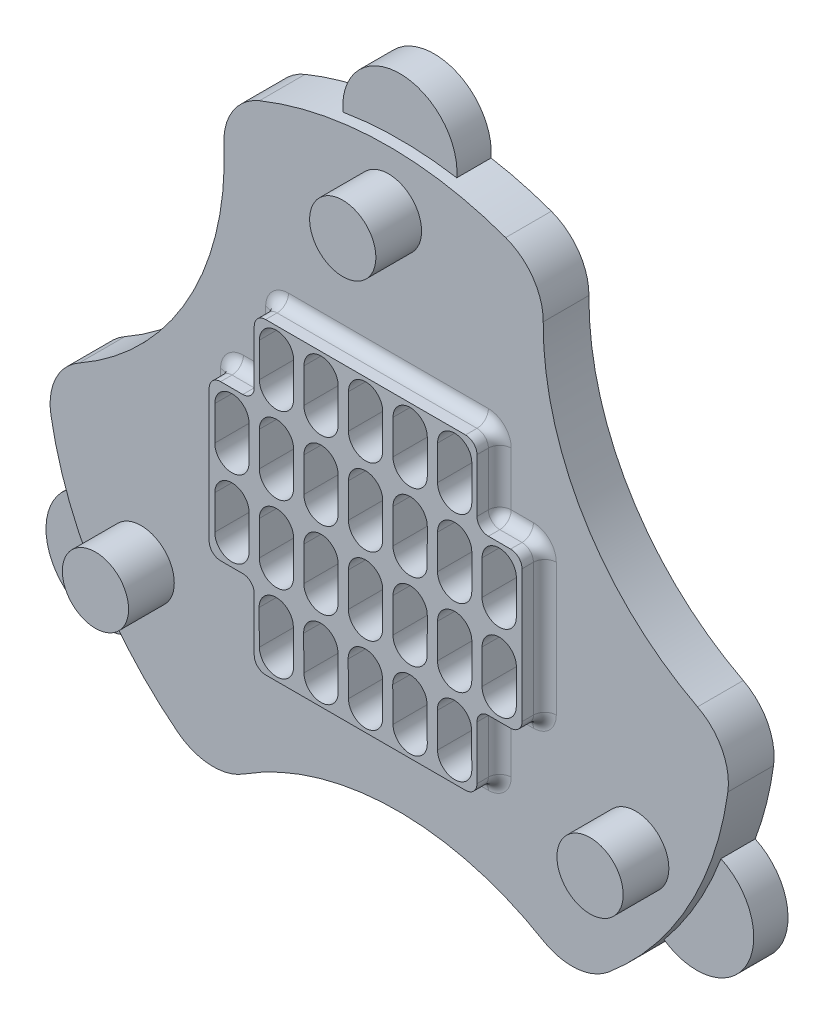
from build123d import *

# Parameters (mm, degrees)
SKETCH2_R                = 18.85
BOSS_EXTRUDE1_DEPTH      = 4
SKETCH3_R                = 30
SKETCH3_R_2              = 17.600030795
BOSS_EXTRUDE2_DEPTH      = 4
BOSS_EXTRUDE3_DEPTH      = 4
BOSS_EXTRUDE3_DEPTH_BACK = 4
SKETCH4_R                = 2.9
SKETCH6_R                = 5
BOSS_EXTRUDE4_DEPTH      = 3
SKETCH7_R                = 25
CUT_EXTRUDE2_DEPTH       = 4
FILLET1_R                = 5
SKETCH2_2_R              = 18.85
BOSS_EXTRUDE5_DEPTH      = 6
SKETCH8_R                = 20.511068925
CUT_EXTRUDE3_DEPTH       = 2
FILLET2_R                = 1
FILLET3_R                = 1


with BuildPart() as part:
    # Sketch2 → Boss-Extrude1 (new body)
    with BuildSketch(Plane.XY.offset(10)):
        Circle(SKETCH2_R)
        with BuildLine():
            Line((-6.300750604, 11.631897337), (-6.301949779, 8.631897576))
            ThreePointArc((-6.301949779, 8.631897576), (-7.802549247, 7.132497284), (-9.30194954, 8.633096752))
            Line((-9.30194954, 8.633096752), (-9.300750364, 11.633096512))
            ThreePointArc((-9.300750364, 11.633096512), (-7.800150896, 13.132496805), (-6.300750604, 11.631897337))
        make_face(mode=Mode.SUBTRACT)
        with BuildLine():
            Line((-5.400750364, 11.633096512), (-5.40194954, 8.633096752))
            ThreePointArc((-5.40194954, 8.633096752), (-3.902549247, 7.132497284), (-2.401949779, 8.631897576))
            Line((-2.401949779, 8.631897576), (-2.400750604, 11.631897337))
            ThreePointArc((-2.400750604, 11.631897337), (-3.900150896, 13.132496805), (-5.400750364, 11.633096512))
        make_face(mode=Mode.SUBTRACT)
        with BuildLine():
            Line((-1.500750364, 11.633096512), (-1.50194954, 8.633096752))
            ThreePointArc((-1.50194954, 8.633096752), (-0.002549247, 7.132497284), (1.498050221, 8.631897576))
            Line((1.498050221, 8.631897576), (1.499249396, 11.631897337))
            ThreePointArc((1.499249396, 11.631897337), (-0.000150896, 13.132496805), (-1.500750364, 11.633096512))
        make_face(mode=Mode.SUBTRACT)
        with BuildLine():
            Line((2.399249636, 11.633096512), (2.39805046, 8.633096752))
            ThreePointArc((2.39805046, 8.633096752), (3.897450753, 7.132497284), (5.398050221, 8.631897576))
            Line((5.398050221, 8.631897576), (5.399249396, 11.631897337))
            ThreePointArc((5.399249396, 11.631897337), (3.899849104, 13.132496805), (2.399249636, 11.633096512))
        make_face(mode=Mode.SUBTRACT)
        with BuildLine():
            Line((6.299249636, 11.633096512), (6.29805046, 8.633096752))
            ThreePointArc((6.29805046, 8.633096752), (7.797450753, 7.132497284), (9.298050221, 8.631897576))
            Line((9.298050221, 8.631897576), (9.299249396, 11.631897337))
            ThreePointArc((9.299249396, 11.631897337), (7.799849104, 13.132496805), (6.299249636, 11.633096512))
        make_face(mode=Mode.SUBTRACT)
        with BuildLine():
            Line((-10.203450815, 1.876748439), (-10.201950263, 4.876748439))
            ThreePointArc((-10.201950263, 4.876748439), (-11.701199799, 6.377498527), (-13.201949888, 4.878248991))
            Line((-13.201949888, 4.878248991), (-13.20345044, 1.878248991))
            ThreePointArc((-13.20345044, 1.878248991), (-11.704200903, 0.377498902), (-10.203450815, 1.876748439))
        make_face(mode=Mode.SUBTRACT)
        with BuildLine():
            Line((-9.303450024, 1.878248991), (-9.301949472, 4.878248991))
            ThreePointArc((-9.301949472, 4.878248991), (-7.801199384, 6.377498527), (-6.301949847, 4.876748439))
            Line((-6.301949847, 4.876748439), (-6.3034504, 1.876748439))
            ThreePointArc((-6.3034504, 1.876748439), (-7.804200488, 0.377498902), (-9.303450024, 1.878248991))
        make_face(mode=Mode.SUBTRACT)
        with BuildLine():
            Line((-2.4034504, 1.876748439), (-2.401949847, 4.876748439))
            ThreePointArc((-2.401949847, 4.876748439), (-3.901199384, 6.377498527), (-5.401949472, 4.878248991))
            Line((-5.401949472, 4.878248991), (-5.403450024, 1.878248991))
            ThreePointArc((-5.403450024, 1.878248991), (-3.904200488, 0.377498902), (-2.4034504, 1.876748439))
        make_face(mode=Mode.SUBTRACT)
        with BuildLine():
            Line((1.4965496, 1.876748439), (1.498050153, 4.876748439))
            ThreePointArc((1.498050153, 4.876748439), (-0.001199384, 6.377498527), (-1.501949472, 4.878248991))
            Line((-1.501949472, 4.878248991), (-1.503450024, 1.878248991))
            ThreePointArc((-1.503450024, 1.878248991), (-0.004200488, 0.377498902), (1.4965496, 1.876748439))
        make_face(mode=Mode.SUBTRACT)
        with BuildLine():
            Line((5.3965496, 1.876748439), (5.398050153, 4.876748439))
            ThreePointArc((5.398050153, 4.876748439), (3.898800616, 6.377498527), (2.398050528, 4.878248991))
            Line((2.398050528, 4.878248991), (2.396549976, 1.878248991))
            ThreePointArc((2.396549976, 1.878248991), (3.895799512, 0.377498902), (5.3965496, 1.876748439))
        make_face(mode=Mode.SUBTRACT)
        with BuildLine():
            Line((9.2965496, 1.876748439), (9.298050153, 4.876748439))
            ThreePointArc((9.298050153, 4.876748439), (7.798800616, 6.377498527), (6.298050528, 4.878248991))
            Line((6.298050528, 4.878248991), (6.296549976, 1.878248991))
            ThreePointArc((6.296549976, 1.878248991), (7.795799512, 0.377498902), (9.2965496, 1.876748439))
        make_face(mode=Mode.SUBTRACT)
        with BuildLine():
            Line((13.1965496, 1.876748439), (13.198050153, 4.876748439))
            ThreePointArc((13.198050153, 4.876748439), (11.698800616, 6.377498527), (10.198050528, 4.878248991))
            Line((10.198050528, 4.878248991), (10.196549976, 1.878248991))
            ThreePointArc((10.196549976, 1.878248991), (11.695799512, 0.377498902), (13.1965496, 1.876748439))
        make_face(mode=Mode.SUBTRACT)
        with BuildLine():
            Line((-9.304647729, -4.877109305), (-9.30074961, -1.877109305))
            ThreePointArc((-9.30074961, -1.877109305), (-7.798801818, -0.37905963), (-6.300752142, -1.881007421))
            Line((-6.300752142, -1.881007421), (-6.304650262, -4.881007421))
            ThreePointArc((-6.304650262, -4.881007421), (-7.806598054, -6.379057097), (-9.304647729, -4.877109305))
        make_face(mode=Mode.SUBTRACT)
        with BuildLine():
            Line((-2.404650262, -4.881007421), (-2.400752142, -1.881007421))
            ThreePointArc((-2.400752142, -1.881007421), (-3.898801818, -0.37905963), (-5.40074961, -1.877109305))
            Line((-5.40074961, -1.877109305), (-5.404647729, -4.877109305))
            ThreePointArc((-5.404647729, -4.877109305), (-3.906598054, -6.379057097), (-2.404650262, -4.881007421))
        make_face(mode=Mode.SUBTRACT)
        with BuildLine():
            Line((1.495349738, -4.881007421), (1.499247858, -1.881007421))
            ThreePointArc((1.499247858, -1.881007421), (0.001198182, -0.37905963), (-1.50074961, -1.877109305))
            Line((-1.50074961, -1.877109305), (-1.504647729, -4.877109305))
            ThreePointArc((-1.504647729, -4.877109305), (-0.006598054, -6.379057097), (1.495349738, -4.881007421))
        make_face(mode=Mode.SUBTRACT)
        with BuildLine():
            Line((5.395349738, -4.881007421), (5.399247858, -1.881007421))
            ThreePointArc((5.399247858, -1.881007421), (3.901198182, -0.37905963), (2.39925039, -1.877109305))
            Line((2.39925039, -1.877109305), (2.395352271, -4.877109305))
            ThreePointArc((2.395352271, -4.877109305), (3.893401946, -6.379057097), (5.395349738, -4.881007421))
        make_face(mode=Mode.SUBTRACT)
        with BuildLine():
            Line((9.295349738, -4.881007421), (9.299247858, -1.881007421))
            ThreePointArc((9.299247858, -1.881007421), (7.801198182, -0.37905963), (6.29925039, -1.877109305))
            Line((6.29925039, -1.877109305), (6.295352271, -4.877109305))
            ThreePointArc((6.295352271, -4.877109305), (7.793401946, -6.379057097), (9.295349738, -4.881007421))
        make_face(mode=Mode.SUBTRACT)
        with BuildLine():
            Line((13.195349738, -4.881007421), (13.199247858, -1.881007421))
            ThreePointArc((13.199247858, -1.881007421), (11.701198182, -0.37905963), (10.19925039, -1.877109305))
            Line((10.19925039, -1.877109305), (10.195352271, -4.877109305))
            ThreePointArc((10.195352271, -4.877109305), (11.693401946, -6.379057097), (13.195349738, -4.881007421))
        make_face(mode=Mode.SUBTRACT)
        with BuildLine():
            Line((-10.204650262, -4.881007421), (-10.200752142, -1.881007421))
            ThreePointArc((-10.200752142, -1.881007421), (-11.698801818, -0.37905963), (-13.20074961, -1.877109305))
            Line((-13.20074961, -1.877109305), (-13.204647729, -4.877109305))
            ThreePointArc((-13.204647729, -4.877109305), (-11.706598054, -6.379057097), (-10.204650262, -4.881007421))
        make_face(mode=Mode.SUBTRACT)
        with BuildLine():
            Line((-6.325942117, -8.623046013), (-6.300802019, -11.623046013))
            ThreePointArc((-6.300802019, -11.623046013), (-7.788179745, -13.135562955), (-9.300696687, -11.648185229))
            Line((-9.300696687, -11.648185229), (-9.325836785, -8.648185229))
            ThreePointArc((-9.325836785, -8.648185229), (-7.838459059, -7.135668287), (-6.325942117, -8.623046013))
        make_face(mode=Mode.SUBTRACT)
        with BuildLine():
            Line((-5.425836785, -8.648185229), (-5.400696687, -11.648185229))
            ThreePointArc((-5.400696687, -11.648185229), (-3.888179745, -13.135562955), (-2.400802019, -11.623046013))
            Line((-2.400802019, -11.623046013), (-2.425942117, -8.623046013))
            ThreePointArc((-2.425942117, -8.623046013), (-3.938459059, -7.135668287), (-5.425836785, -8.648185229))
        make_face(mode=Mode.SUBTRACT)
        with BuildLine():
            Line((-1.525836785, -8.648185229), (-1.500696687, -11.648185229))
            ThreePointArc((-1.500696687, -11.648185229), (0.011820255, -13.135562955), (1.499197981, -11.623046013))
            Line((1.499197981, -11.623046013), (1.474057883, -8.623046013))
            ThreePointArc((1.474057883, -8.623046013), (-0.038459059, -7.135668287), (-1.525836785, -8.648185229))
        make_face(mode=Mode.SUBTRACT)
        with BuildLine():
            Line((2.374163215, -8.648185229), (2.399303313, -11.648185229))
            ThreePointArc((2.399303313, -11.648185229), (3.911820255, -13.135562955), (5.399197981, -11.623046013))
            Line((5.399197981, -11.623046013), (5.374057883, -8.623046013))
            ThreePointArc((5.374057883, -8.623046013), (3.861540941, -7.135668287), (2.374163215, -8.648185229))
        make_face(mode=Mode.SUBTRACT)
        with BuildLine():
            Line((6.274163215, -8.648185229), (6.299303313, -11.648185229))
            ThreePointArc((6.299303313, -11.648185229), (7.811820255, -13.135562955), (9.299197981, -11.623046013))
            Line((9.299197981, -11.623046013), (9.274057883, -8.623046013))
            ThreePointArc((9.274057883, -8.623046013), (7.761540941, -7.135668287), (6.274163215, -8.648185229))
        make_face(mode=Mode.SUBTRACT)
    extrude(amount=BOSS_EXTRUDE1_DEPTH)

    # Sketch3 → Boss-Extrude2 (add)
    with BuildSketch(Plane.XY.offset(14)):
        Circle(SKETCH3_R)
        Circle(SKETCH3_R_2, mode=Mode.SUBTRACT)
    extrude(amount=-BOSS_EXTRUDE2_DEPTH)

    # Sketch4 → Boss-Extrude3 (add, two sides: drawn at the far end of the back side and taken through both)
    with BuildSketch(Plane.XY.offset(14).offset(-BOSS_EXTRUDE3_DEPTH_BACK)):
        with Locations((0, 25)):
            Circle(SKETCH4_R)
        with Locations((21.650635095, -12.5)):
            Circle(SKETCH4_R)
        with Locations((-21.650635095, -12.5)):
            Circle(SKETCH4_R)
    extrude(amount=BOSS_EXTRUDE3_DEPTH + BOSS_EXTRUDE3_DEPTH_BACK)

    # Sketch6 → Boss-Extrude4 (add)
    with BuildSketch(Plane(origin=(0, 0, 10), x_dir=(-1, 0, 0), z_dir=(0, 0, -1))):
        with Locations((0, 30)):
            Circle(SKETCH6_R)
        with Locations((25.980762114, -15)):
            Circle(SKETCH6_R)
        with Locations((-25.980762114, -15)):
            Circle(SKETCH6_R)
    extrude(amount=-BOSS_EXTRUDE4_DEPTH)

    # Sketch7 → Cut-Extrude2 (cut)
    with BuildSketch(Plane(origin=(0, 0, 10), x_dir=(-1, 0, 0), z_dir=(0, 0, -1))):
        with Locations((-38.550089681, 23.214017006)):
            Circle(SKETCH7_R)
        with Locations((39.378973292, 21.778348479)):
            Circle(SKETCH7_R)
        with Locations((-0.828883611, -44.992365485)):
            Circle(SKETCH7_R)
    extrude(amount=-CUT_EXTRUDE2_DEPTH, mode=Mode.SUBTRACT)

    # Fillet1
    fillet1_edges = [part.edges().sort_by_distance(p)[0] for p in [
        (-14.758617972, 26.118636939, 12),
        (-29.968117125, -1.382734963, 12),
        (-15.240094116, -25.840656558, 12),
        (16.181542167, -25.261783252, 12),
        (29.998712087, -0.277980381, 12),
        (13.786574958, 26.644518215, 12),
    ]]
    fillet(fillet1_edges, radius=FILLET1_R)

    # Sketch2<2> → Boss-Extrude5 (add)
    with BuildSketch(Plane.XY.offset(10)):
        Circle(SKETCH2_2_R)
        with BuildLine():
            Line((-6.300750604, 11.631897337), (-6.301949779, 8.631897576))
            ThreePointArc((-6.301949779, 8.631897576), (-7.802549247, 7.132497284), (-9.30194954, 8.633096752))
            Line((-9.30194954, 8.633096752), (-9.300750364, 11.633096512))
            ThreePointArc((-9.300750364, 11.633096512), (-7.800150896, 13.132496805), (-6.300750604, 11.631897337))
        make_face(mode=Mode.SUBTRACT)
        with BuildLine():
            Line((-5.400750364, 11.633096512), (-5.40194954, 8.633096752))
            ThreePointArc((-5.40194954, 8.633096752), (-3.902549247, 7.132497284), (-2.401949779, 8.631897576))
            Line((-2.401949779, 8.631897576), (-2.400750604, 11.631897337))
            ThreePointArc((-2.400750604, 11.631897337), (-3.900150896, 13.132496805), (-5.400750364, 11.633096512))
        make_face(mode=Mode.SUBTRACT)
        with BuildLine():
            Line((-1.500750364, 11.633096512), (-1.50194954, 8.633096752))
            ThreePointArc((-1.50194954, 8.633096752), (-0.002549247, 7.132497284), (1.498050221, 8.631897576))
            Line((1.498050221, 8.631897576), (1.499249396, 11.631897337))
            ThreePointArc((1.499249396, 11.631897337), (-0.000150896, 13.132496805), (-1.500750364, 11.633096512))
        make_face(mode=Mode.SUBTRACT)
        with BuildLine():
            Line((2.399249636, 11.633096512), (2.39805046, 8.633096752))
            ThreePointArc((2.39805046, 8.633096752), (3.897450753, 7.132497284), (5.398050221, 8.631897576))
            Line((5.398050221, 8.631897576), (5.399249396, 11.631897337))
            ThreePointArc((5.399249396, 11.631897337), (3.899849104, 13.132496805), (2.399249636, 11.633096512))
        make_face(mode=Mode.SUBTRACT)
        with BuildLine():
            Line((6.299249636, 11.633096512), (6.29805046, 8.633096752))
            ThreePointArc((6.29805046, 8.633096752), (7.797450753, 7.132497284), (9.298050221, 8.631897576))
            Line((9.298050221, 8.631897576), (9.299249396, 11.631897337))
            ThreePointArc((9.299249396, 11.631897337), (7.799849104, 13.132496805), (6.299249636, 11.633096512))
        make_face(mode=Mode.SUBTRACT)
        with BuildLine():
            Line((-10.203450815, 1.876748439), (-10.201950263, 4.876748439))
            ThreePointArc((-10.201950263, 4.876748439), (-11.701199799, 6.377498527), (-13.201949888, 4.878248991))
            Line((-13.201949888, 4.878248991), (-13.20345044, 1.878248991))
            ThreePointArc((-13.20345044, 1.878248991), (-11.704200903, 0.377498902), (-10.203450815, 1.876748439))
        make_face(mode=Mode.SUBTRACT)
        with BuildLine():
            Line((-9.303450024, 1.878248991), (-9.301949472, 4.878248991))
            ThreePointArc((-9.301949472, 4.878248991), (-7.801199384, 6.377498527), (-6.301949847, 4.876748439))
            Line((-6.301949847, 4.876748439), (-6.3034504, 1.876748439))
            ThreePointArc((-6.3034504, 1.876748439), (-7.804200488, 0.377498902), (-9.303450024, 1.878248991))
        make_face(mode=Mode.SUBTRACT)
        with BuildLine():
            Line((-2.4034504, 1.876748439), (-2.401949847, 4.876748439))
            ThreePointArc((-2.401949847, 4.876748439), (-3.901199384, 6.377498527), (-5.401949472, 4.878248991))
            Line((-5.401949472, 4.878248991), (-5.403450024, 1.878248991))
            ThreePointArc((-5.403450024, 1.878248991), (-3.904200488, 0.377498902), (-2.4034504, 1.876748439))
        make_face(mode=Mode.SUBTRACT)
        with BuildLine():
            Line((1.4965496, 1.876748439), (1.498050153, 4.876748439))
            ThreePointArc((1.498050153, 4.876748439), (-0.001199384, 6.377498527), (-1.501949472, 4.878248991))
            Line((-1.501949472, 4.878248991), (-1.503450024, 1.878248991))
            ThreePointArc((-1.503450024, 1.878248991), (-0.004200488, 0.377498902), (1.4965496, 1.876748439))
        make_face(mode=Mode.SUBTRACT)
        with BuildLine():
            Line((5.3965496, 1.876748439), (5.398050153, 4.876748439))
            ThreePointArc((5.398050153, 4.876748439), (3.898800616, 6.377498527), (2.398050528, 4.878248991))
            Line((2.398050528, 4.878248991), (2.396549976, 1.878248991))
            ThreePointArc((2.396549976, 1.878248991), (3.895799512, 0.377498902), (5.3965496, 1.876748439))
        make_face(mode=Mode.SUBTRACT)
        with BuildLine():
            Line((9.2965496, 1.876748439), (9.298050153, 4.876748439))
            ThreePointArc((9.298050153, 4.876748439), (7.798800616, 6.377498527), (6.298050528, 4.878248991))
            Line((6.298050528, 4.878248991), (6.296549976, 1.878248991))
            ThreePointArc((6.296549976, 1.878248991), (7.795799512, 0.377498902), (9.2965496, 1.876748439))
        make_face(mode=Mode.SUBTRACT)
        with BuildLine():
            Line((13.1965496, 1.876748439), (13.198050153, 4.876748439))
            ThreePointArc((13.198050153, 4.876748439), (11.698800616, 6.377498527), (10.198050528, 4.878248991))
            Line((10.198050528, 4.878248991), (10.196549976, 1.878248991))
            ThreePointArc((10.196549976, 1.878248991), (11.695799512, 0.377498902), (13.1965496, 1.876748439))
        make_face(mode=Mode.SUBTRACT)
        with BuildLine():
            Line((-9.304647729, -4.877109305), (-9.30074961, -1.877109305))
            ThreePointArc((-9.30074961, -1.877109305), (-7.798801818, -0.37905963), (-6.300752142, -1.881007421))
            Line((-6.300752142, -1.881007421), (-6.304650262, -4.881007421))
            ThreePointArc((-6.304650262, -4.881007421), (-7.806598054, -6.379057097), (-9.304647729, -4.877109305))
        make_face(mode=Mode.SUBTRACT)
        with BuildLine():
            Line((-2.404650262, -4.881007421), (-2.400752142, -1.881007421))
            ThreePointArc((-2.400752142, -1.881007421), (-3.898801818, -0.37905963), (-5.40074961, -1.877109305))
            Line((-5.40074961, -1.877109305), (-5.404647729, -4.877109305))
            ThreePointArc((-5.404647729, -4.877109305), (-3.906598054, -6.379057097), (-2.404650262, -4.881007421))
        make_face(mode=Mode.SUBTRACT)
        with BuildLine():
            Line((1.495349738, -4.881007421), (1.499247858, -1.881007421))
            ThreePointArc((1.499247858, -1.881007421), (0.001198182, -0.37905963), (-1.50074961, -1.877109305))
            Line((-1.50074961, -1.877109305), (-1.504647729, -4.877109305))
            ThreePointArc((-1.504647729, -4.877109305), (-0.006598054, -6.379057097), (1.495349738, -4.881007421))
        make_face(mode=Mode.SUBTRACT)
        with BuildLine():
            Line((5.395349738, -4.881007421), (5.399247858, -1.881007421))
            ThreePointArc((5.399247858, -1.881007421), (3.901198182, -0.37905963), (2.39925039, -1.877109305))
            Line((2.39925039, -1.877109305), (2.395352271, -4.877109305))
            ThreePointArc((2.395352271, -4.877109305), (3.893401946, -6.379057097), (5.395349738, -4.881007421))
        make_face(mode=Mode.SUBTRACT)
        with BuildLine():
            Line((9.295349738, -4.881007421), (9.299247858, -1.881007421))
            ThreePointArc((9.299247858, -1.881007421), (7.801198182, -0.37905963), (6.29925039, -1.877109305))
            Line((6.29925039, -1.877109305), (6.295352271, -4.877109305))
            ThreePointArc((6.295352271, -4.877109305), (7.793401946, -6.379057097), (9.295349738, -4.881007421))
        make_face(mode=Mode.SUBTRACT)
        with BuildLine():
            Line((13.195349738, -4.881007421), (13.199247858, -1.881007421))
            ThreePointArc((13.199247858, -1.881007421), (11.701198182, -0.37905963), (10.19925039, -1.877109305))
            Line((10.19925039, -1.877109305), (10.195352271, -4.877109305))
            ThreePointArc((10.195352271, -4.877109305), (11.693401946, -6.379057097), (13.195349738, -4.881007421))
        make_face(mode=Mode.SUBTRACT)
        with BuildLine():
            Line((-10.204650262, -4.881007421), (-10.200752142, -1.881007421))
            ThreePointArc((-10.200752142, -1.881007421), (-11.698801818, -0.37905963), (-13.20074961, -1.877109305))
            Line((-13.20074961, -1.877109305), (-13.204647729, -4.877109305))
            ThreePointArc((-13.204647729, -4.877109305), (-11.706598054, -6.379057097), (-10.204650262, -4.881007421))
        make_face(mode=Mode.SUBTRACT)
        with BuildLine():
            Line((-6.325942117, -8.623046013), (-6.300802019, -11.623046013))
            ThreePointArc((-6.300802019, -11.623046013), (-7.788179745, -13.135562955), (-9.300696687, -11.648185229))
            Line((-9.300696687, -11.648185229), (-9.325836785, -8.648185229))
            ThreePointArc((-9.325836785, -8.648185229), (-7.838459059, -7.135668287), (-6.325942117, -8.623046013))
        make_face(mode=Mode.SUBTRACT)
        with BuildLine():
            Line((-5.425836785, -8.648185229), (-5.400696687, -11.648185229))
            ThreePointArc((-5.400696687, -11.648185229), (-3.888179745, -13.135562955), (-2.400802019, -11.623046013))
            Line((-2.400802019, -11.623046013), (-2.425942117, -8.623046013))
            ThreePointArc((-2.425942117, -8.623046013), (-3.938459059, -7.135668287), (-5.425836785, -8.648185229))
        make_face(mode=Mode.SUBTRACT)
        with BuildLine():
            Line((-1.525836785, -8.648185229), (-1.500696687, -11.648185229))
            ThreePointArc((-1.500696687, -11.648185229), (0.011820255, -13.135562955), (1.499197981, -11.623046013))
            Line((1.499197981, -11.623046013), (1.474057883, -8.623046013))
            ThreePointArc((1.474057883, -8.623046013), (-0.038459059, -7.135668287), (-1.525836785, -8.648185229))
        make_face(mode=Mode.SUBTRACT)
        with BuildLine():
            Line((2.374163215, -8.648185229), (2.399303313, -11.648185229))
            ThreePointArc((2.399303313, -11.648185229), (3.911820255, -13.135562955), (5.399197981, -11.623046013))
            Line((5.399197981, -11.623046013), (5.374057883, -8.623046013))
            ThreePointArc((5.374057883, -8.623046013), (3.861540941, -7.135668287), (2.374163215, -8.648185229))
        make_face(mode=Mode.SUBTRACT)
        with BuildLine():
            Line((6.274163215, -8.648185229), (6.299303313, -11.648185229))
            ThreePointArc((6.299303313, -11.648185229), (7.811820255, -13.135562955), (9.299197981, -11.623046013))
            Line((9.299197981, -11.623046013), (9.274057883, -8.623046013))
            ThreePointArc((9.274057883, -8.623046013), (7.761540941, -7.135668287), (6.274163215, -8.648185229))
        make_face(mode=Mode.SUBTRACT)
    extrude(amount=BOSS_EXTRUDE5_DEPTH)

    # Sketch8 → Cut-Extrude3 (cut)
    with BuildSketch(Plane.XY.offset(16)):
        Circle(SKETCH8_R)
        Polygon((-9.74952037, -13.473579653), (-9.74952037, -6.792613611), (-13.695327423, -6.792613611), (-13.695327423, 6.792613611), (-9.74952037, 6.792613611), (-9.74952037, 13.473579653), (9.74952037, 13.473579653), (9.74952037, 6.792613611), (13.695327423, 6.792613611), (13.695327423, -6.792613611), (9.74952037, -6.792613611), (9.74952037, -13.473579653), align=None, mode=Mode.SUBTRACT)
    extrude(amount=-CUT_EXTRUDE3_DEPTH, mode=Mode.SUBTRACT)

    # Fillet2
    fillet2_edges = [part.edges().sort_by_distance(p)[0] for p in [
        (9.74952037, 13.473579653, 15),
        (9.74952037, 6.792613611, 15),
        (13.695327423, 6.792613611, 15),
        (13.695327423, -6.792613611, 15),
        (9.74952037, -6.792613611, 15),
        (9.74952037, -13.473579653, 15),
        (-9.74952037, -13.473579653, 15),
        (-9.74952037, -6.792613611, 15),
        (-13.695327423, -6.792613611, 15),
        (-13.695327423, 6.792613611, 15),
        (-9.74952037, 6.792613611, 15),
        (-9.74952037, 13.473579653, 15),
    ]]
    fillet(fillet2_edges, radius=FILLET2_R)

    # Fillet3
    fillet3_edges = [part.edges().sort_by_distance(p)[0] for p in [
        (-9.456627151, 13.180686434, 14),
        (0, 13.473579653, 14),
        (9.456627151, 13.180686434, 14),
        (9.74952037, 10.133096632, 14),
        (10.042413589, 7.08550683, 14),
        (11.722423897, 6.792613611, 14),
        (13.402434205, 6.499720393, 14),
        (13.695327423, 0, 14),
        (13.402434205, -6.499720393, 14),
        (11.722423897, -6.792613611, 14),
        (10.042413589, -7.08550683, 14),
        (9.74952037, -10.133096632, 14),
        (9.456627151, -13.180686434, 14),
        (0, -13.473579653, 14),
        (-9.456627151, -13.180686434, 14),
        (-9.74952037, -10.133096632, 14),
        (-10.042413589, -7.08550683, 14),
        (-11.722423897, -6.792613611, 14),
        (-13.402434205, -6.499720393, 14),
        (-13.695327423, 0, 14),
        (-13.402434205, 6.499720393, 14),
        (-11.722423897, 6.792613611, 14),
        (-10.042413589, 7.08550683, 14),
        (-9.74952037, 10.133096632, 14),
    ]]
    fillet(fillet3_edges, radius=FILLET3_R)


solid = part.part
